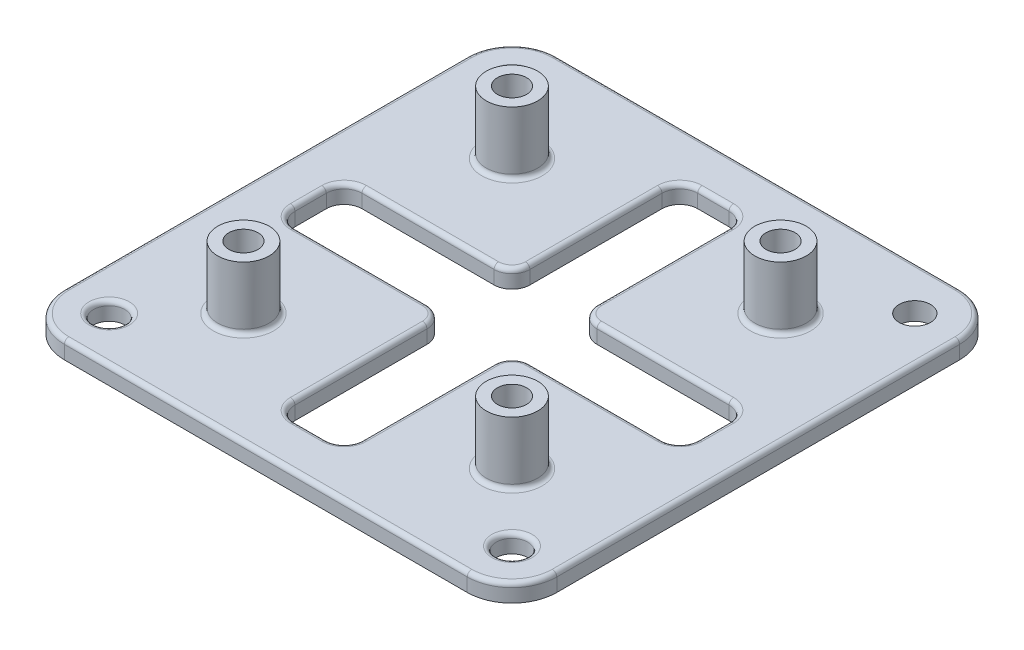
from build123d import *

# Parameters (mm, degrees)
SKETCH1_R           = 1.75
BOSS_EXTRUDE1_DEPTH = 2
SKETCH2_R           = 2.875
SKETCH2_R_2         = 1.625
BOSS_EXTRUDE2_DEPTH = 7
FILLET3_R           = 2
CUT_EXTRUDE1_START  = -7
SKETCH3_R           = 1.625
CUT_EXTRUDE1_DEPTH  = 7
FILLET4_R           = 0.5


with BuildPart() as part:
    # Sketch1 → Boss-Extrude1 (new body)
    with BuildSketch(Plane(origin=(0, 0, 0), x_dir=(1, 0, 0), z_dir=(0, 1, 0))):
        with BuildLine():
            Line((-22.5, 27.5), (22.5, 27.5))
            ThreePointArc((22.5, 27.5), (26.035533906, 26.035533906), (27.5, 22.5))
            Line((27.5, 22.5), (27.5, -22.5))
            ThreePointArc((27.5, -22.5), (26.035533906, -26.035533906), (22.5, -27.5))
            Line((22.5, -27.5), (-22.5, -27.5))
            ThreePointArc((-22.5, -27.5), (-26.035533906, -26.035533906), (-27.5, -22.5))
            Line((-27.5, -22.5), (-27.5, 22.5))
            ThreePointArc((-27.5, 22.5), (-26.035533906, 26.035533906), (-22.5, 27.5))
        make_face()
        with Locations(Location((-22.5, 22.5, 0), (0, 0, 270))):
            Circle(SKETCH1_R, mode=Mode.SUBTRACT)
        with Locations(Location((22.5, 22.5, 0), (0, 0, 270))):
            Circle(SKETCH1_R, mode=Mode.SUBTRACT)
        with Locations(Location((22.5, -22.5, 0), (0, 0, 270))):
            Circle(SKETCH1_R, mode=Mode.SUBTRACT)
        with Locations(Location((-22.5, -22.5, 0), (0, 0, 270))):
            Circle(SKETCH1_R, mode=Mode.SUBTRACT)
        Polygon((-3.75, -3.75), (-3.75, -22.5), (3.75, -22.5), (3.75, -3.75), (22.5, -3.75), (22.5, 3.75), (3.75, 3.75), (3.75, 22.5), (-3.75, 22.5), (-3.75, 3.75), (-22.5, 3.75), (-22.5, -3.75), align=None, mode=Mode.SUBTRACT)
    extrude(amount=BOSS_EXTRUDE1_DEPTH)

    # Sketch2 → Boss-Extrude2 (add)
    # profile 1 of 4: a face of its own
    with BuildSketch(Plane(origin=(0, 2, 0), x_dir=(1, 0, 0), z_dir=(0, 1, 0))):
        with Locations(Location((-15, 15, 0), (0, 0, 90))):
            Circle(SKETCH2_R)
        with Locations(Location((-15, 15, 0), (0, 0, 270))):
            Circle(SKETCH2_R_2, mode=Mode.SUBTRACT)
    # profile 2 of 4: a face of its own
    with BuildSketch(Plane(origin=(0, 2, 0), x_dir=(1, 0, 0), z_dir=(0, 1, 0))):
        with Locations(Location((15, 15, 0), (0, 0, 90))):
            Circle(SKETCH2_R)
        with Locations(Location((15, 15, 0), (0, 0, 270))):
            Circle(SKETCH2_R_2, mode=Mode.SUBTRACT)
    # profile 3 of 4: a face of its own
    with BuildSketch(Plane(origin=(0, 2, 0), x_dir=(1, 0, 0), z_dir=(0, 1, 0))):
        with Locations(Location((15, -15, 0), (0, 0, 90))):
            Circle(SKETCH2_R)
        with Locations(Location((15, -15, 0), (0, 0, 270))):
            Circle(SKETCH2_R_2, mode=Mode.SUBTRACT)
    # profile 4 of 4: a face of its own
    with BuildSketch(Plane(origin=(0, 2, 0), x_dir=(1, 0, 0), z_dir=(0, 1, 0))):
        with Locations(Location((-15, -15, 0), (0, 0, 90))):
            Circle(SKETCH2_R)
        with Locations(Location((-15, -15, 0), (0, 0, 270))):
            Circle(SKETCH2_R_2, mode=Mode.SUBTRACT)
    extrude(amount=BOSS_EXTRUDE2_DEPTH)

    # Fillet3
    fillet3_edges = [part.edges().sort_by_distance(p)[0] for p in [
        (3.75, 1, 22.5),
        (3.75, 1, 3.75),
        (22.5, 1, 3.75),
        (22.5, 1, -3.75),
        (3.75, 1, -3.75),
        (3.75, 1, -22.5),
        (-3.75, 1, -22.5),
        (-3.75, 1, -3.75),
        (-22.5, 1, -3.75),
        (-22.5, 1, 3.75),
        (-3.75, 1, 3.75),
        (-3.75, 1, 22.5),
    ]]
    fillet(fillet3_edges, radius=FILLET3_R)

    # Sketch3 → Cut-Extrude1 (cut)
    with BuildSketch(Plane(origin=(0, 2, 0), x_dir=(1, 0, 0), z_dir=(0, 1, 0)).offset(CUT_EXTRUDE1_START)):
        with Locations(Location((-15, 15, 0), (0, 0, 90))):
            Circle(SKETCH3_R)
        with Locations(Location((15, 15, 0), (0, 0, 90))):
            Circle(SKETCH3_R)
        with Locations(Location((15, -15, 0), (0, 0, 90))):
            Circle(SKETCH3_R)
        with Locations(Location((-15, -15, 0), (0, 0, 90))):
            Circle(SKETCH3_R)
    extrude(amount=CUT_EXTRUDE1_DEPTH, mode=Mode.SUBTRACT)

    # Fillet4
    fillet4_edges = [part.edges().sort_by_distance(p)[0] for p in [
        (26.035533906, 2, -26.035533906),
        (0, 2, -22.5),
        (-3.75, 2, -13.125),
        (3.75, 2, -13.125),
        (-13.125, 2, -3.75),
        (3.75, 2, 13.125),
        (0, 2, 22.5),
        (-3.75, 2, 13.125),
        (-13.125, 2, 3.75),
        (-22.5, 2, 0),
        (13.125, 2, -3.75),
        (22.5, 2, 0),
        (13.125, 2, 3.75),
        (-4.335786438, 2, 4.335786438),
        (4.335786438, 2, 4.335786438),
        (4.335786438, 2, -4.335786438),
        (-4.335786438, 2, -4.335786438),
        (0, 2, -27.5),
        (-3.164213562, 2, -21.914213562),
        (3.164213562, 2, -21.914213562),
        (21.914213562, 2, -3.164213562),
        (21.914213562, 2, 3.164213562),
        (3.164213562, 2, 21.914213562),
        (-3.164213562, 2, 21.914213562),
        (-21.914213562, 2, 3.164213562),
        (-21.914213562, 2, -3.164213562),
        (-26.035533906, 2, -26.035533906),
        (-27.5, 2, 0),
        (-22.5, 2, -24.25),
        (-26.035533906, 2, 26.035533906),
        (0, 2, 27.5),
        (22.5, 2, 20.75),
        (-22.5, 2, 20.75),
        (26.035533906, 2, 26.035533906),
        (27.5, 2, 0),
        (-15, 2, -12.125),
        (15, 2, -12.125),
        (15, 2, 17.875),
        (-15, 2, 17.875),
    ]]
    fillet(fillet4_edges, radius=FILLET4_R)


solid = part.part
